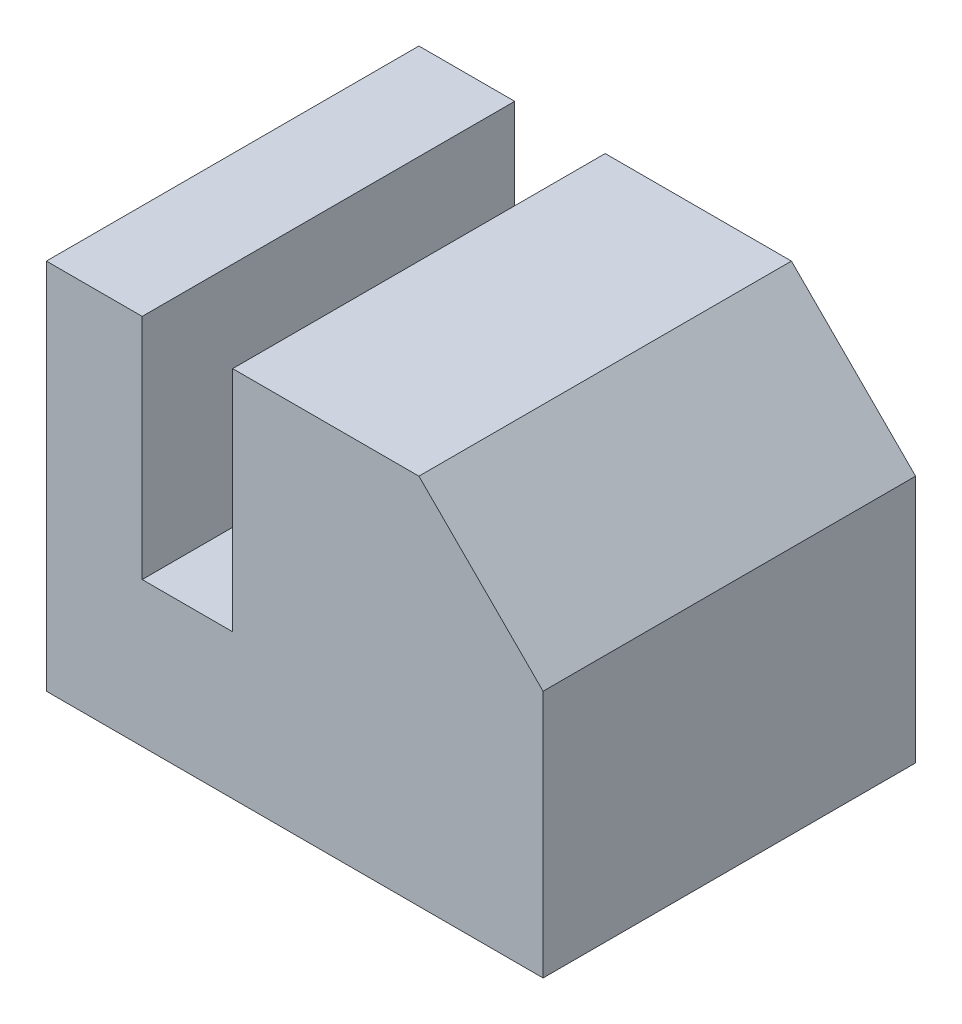
from build123d import *

# Parameters (mm, degrees)
SKETCH_1_W          = 40
SKETCH_1_H          = 30
EXTRUDE_1_DEPTH     = 30
CUT_EXTRUDE_1_DEPTH = 43
SKETCH_3_W          = 7.285636578
SKETCH_3_H          = 18.354132306
CUT_EXTRUDE_2_DEPTH = 30


with BuildPart() as part:
    # 草圖1 → 填料-伸長1 (new body)
    with BuildSketch(Plane.XY):
        Rectangle(SKETCH_1_W, SKETCH_1_H)
    extrude(amount=EXTRUDE_1_DEPTH)

    # 草圖2 → 除料-伸長1 (cut)
    with BuildSketch(Plane.XY.offset(30)):
        Polygon((10, 15), (20, 5), (20, 15), align=None)
    extrude(amount=-CUT_EXTRUDE_1_DEPTH, mode=Mode.SUBTRACT)

    # 草圖3 → 除料-伸長2 (cut)
    with BuildSketch(Plane.XY.offset(30)):
        with Locations((-8.642818289, 5.822933847)):
            Rectangle(SKETCH_3_W, SKETCH_3_H)
    extrude(amount=-CUT_EXTRUDE_2_DEPTH, mode=Mode.SUBTRACT)


solid = part.part
